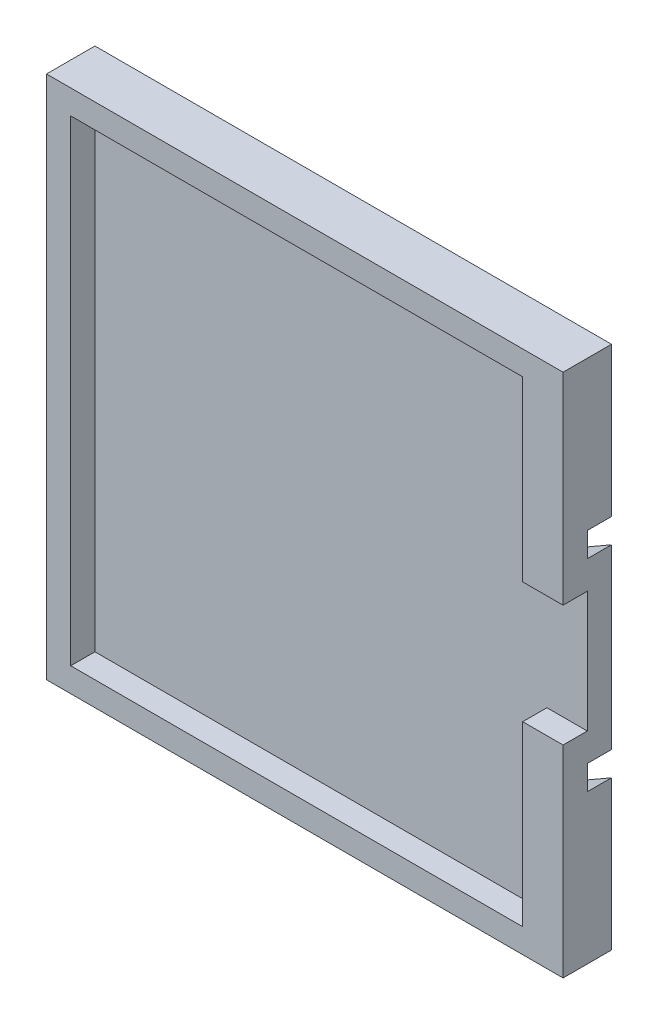
from build123d import *

# Parameters (mm, degrees)
SKETCH1_W           = 34
SKETCH1_H           = 34
BOSS_EXTRUDE1_DEPTH = 6
BOSS_EXTRUDE2_DEPTH = 6


with BuildPart() as part:
    # Sketch1 → Boss-Extrude1 (new body)
    # profile 1 of 4: a face of its own
    with BuildSketch(Plane.XY):
        Polygon((64, 21.972155185), (55.873, 17.280029547), (55.873, 32.719970453), (64, 28.027844815), (64, 65), (-64, 65), (-64, -65), (64, -65), (64, -28.027844815), (55.873, -32.719970453), (55.873, -17.280029547), (64, -21.972155185), align=None)
        with Locations((32, 0)):
            Rectangle(SKETCH1_W, SKETCH1_H, mode=Mode.SUBTRACT)
        with Locations((32, -40)):
            Rectangle(SKETCH1_W, SKETCH1_H, mode=Mode.SUBTRACT)
        with Locations((32, 40)):
            Rectangle(SKETCH1_W, SKETCH1_H, mode=Mode.SUBTRACT)
    # profile 2 of 4: a face of its own
    with BuildSketch(Plane.XY):
        with Locations((32, 0)):
            Rectangle(SKETCH1_W, SKETCH1_H)
    # profile 3 of 4: a face of its own
    with BuildSketch(Plane.XY):
        with Locations((32, 40)):
            Rectangle(SKETCH1_W, SKETCH1_H)
    # profile 4 of 4: a face of its own
    with BuildSketch(Plane.XY):
        with Locations((32, -40)):
            Rectangle(SKETCH1_W, SKETCH1_H)
    extrude(amount=BOSS_EXTRUDE1_DEPTH)

    # Sketch2 → Boss-Extrude2 (add)
    with BuildSketch(Plane.XY.offset(6)):
        Polygon((-64, 65), (64, 65), (64, 15), (54, 15), (54, 59), (-58, 59), (-58, -59), (54, -59), (54, -15), (64, -15), (64, -65), (-64, -65), align=None)
    extrude(amount=BOSS_EXTRUDE2_DEPTH)


solid = part.part
